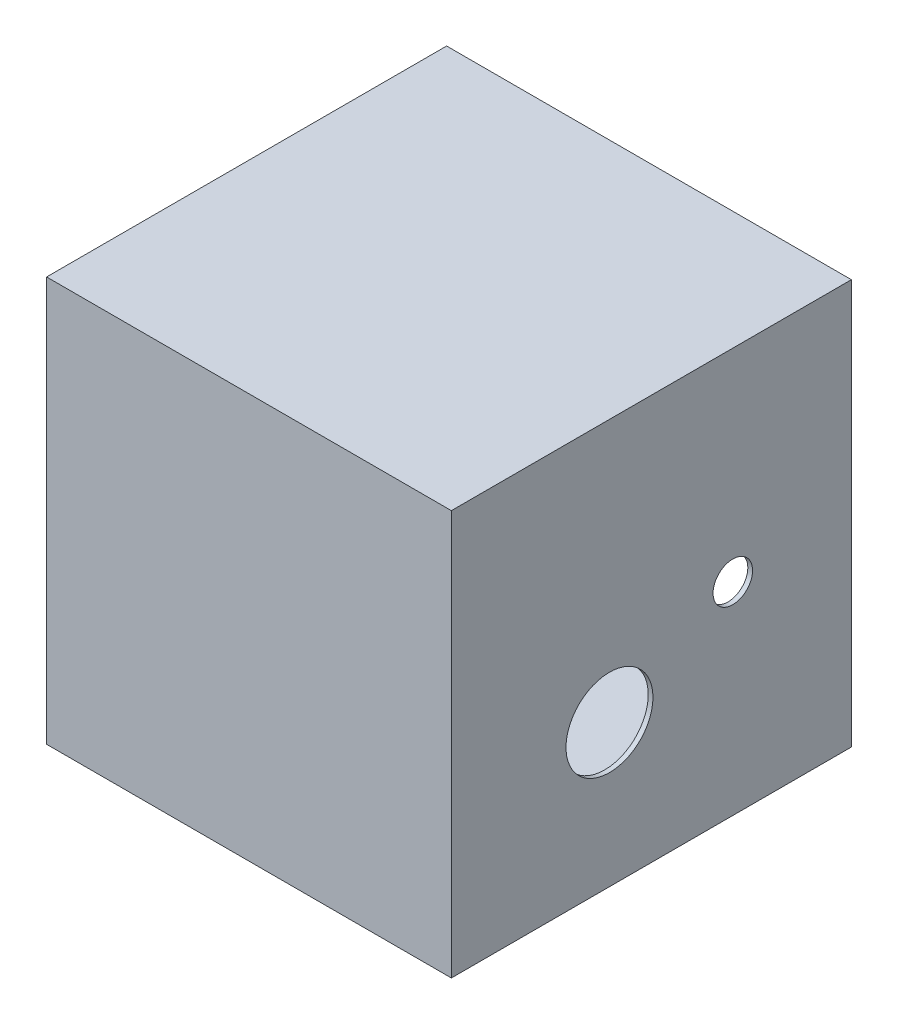
from build123d import *

# Parameters (mm, degrees)
ESBO_O1_W                = 51.2
ESBO_O1_H                = 51.2
ESBO_O1_W_2              = 50
ESBO_O1_H_2              = 50
RESSALTO_EXTRUS_O1_DEPTH = 50
ESBO_O2_W                = 51.2
ESBO_O2_H                = 51.2
RESSALTO_EXTRUS_O2_DEPTH = 0.6
ESBO_O3_R                = 5.5
CORTE_EXTRUS_O1_DEPTH    = 0.6
ESBO_O4_R                = 2.5
CORTE_EXTRUS_O2_DEPTH    = 77.401308889
CORTE_EXTRUS_O3_REACH    = 78.401
ESBO_O5_R                = 2.5


with BuildPart() as part:
    # Esboço1 → Ressalto-extrusão1 (new body)
    with BuildSketch(Plane.XY):
        Rectangle(ESBO_O1_W, ESBO_O1_H)
        Rectangle(ESBO_O1_W_2, ESBO_O1_H_2, mode=Mode.SUBTRACT)
    extrude(amount=RESSALTO_EXTRUS_O1_DEPTH)

    # Esboço2 → Ressalto-extrusão2 (add)
    with BuildSketch(Plane.XY.offset(50)):
        Rectangle(ESBO_O2_W, ESBO_O2_H)
    extrude(amount=RESSALTO_EXTRUS_O2_DEPTH)

    # Esboço3 → Corte-extrusão1 (cut)
    with BuildSketch(Plane(origin=(25.6, 0, 0), x_dir=(0, 0, -1), z_dir=(1, 0, 0))):
        with Locations((-30.6, -7.6)):
            Circle(ESBO_O3_R)
    extrude(amount=-CORTE_EXTRUS_O1_DEPTH, mode=Mode.SUBTRACT)

    # Esboço4 → Corte-extrusão2 (cut, through all)
    with BuildSketch(Plane(origin=(25.6, 0, 0), x_dir=(0, 0, -1), z_dir=(1, 0, 0))):
        with Locations((-15, 0)):
            Circle(ESBO_O4_R)
    extrude(amount=-CORTE_EXTRUS_O2_DEPTH, mode=Mode.SUBTRACT)

    # Esboço5 → Corte-extrusão3 (cut, up to next)
    with BuildSketch(Plane.XZ.offset(25.6), mode=Mode.PRIVATE) as corte_extrus_o3_sk1:
        with Locations(Location((0, 38.6, 0), (0, 0, 270))):
            Circle(ESBO_O5_R)
    corte_extrus_o3_tool1 = extrude(corte_extrus_o3_sk1.sketch, amount=-CORTE_EXTRUS_O3_REACH, mode=Mode.PRIVATE) & part.part
    add(corte_extrus_o3_tool1.solids().sort_by_distance((0, -25.6, 38.6))[0], mode=Mode.SUBTRACT)


solid = part.part
